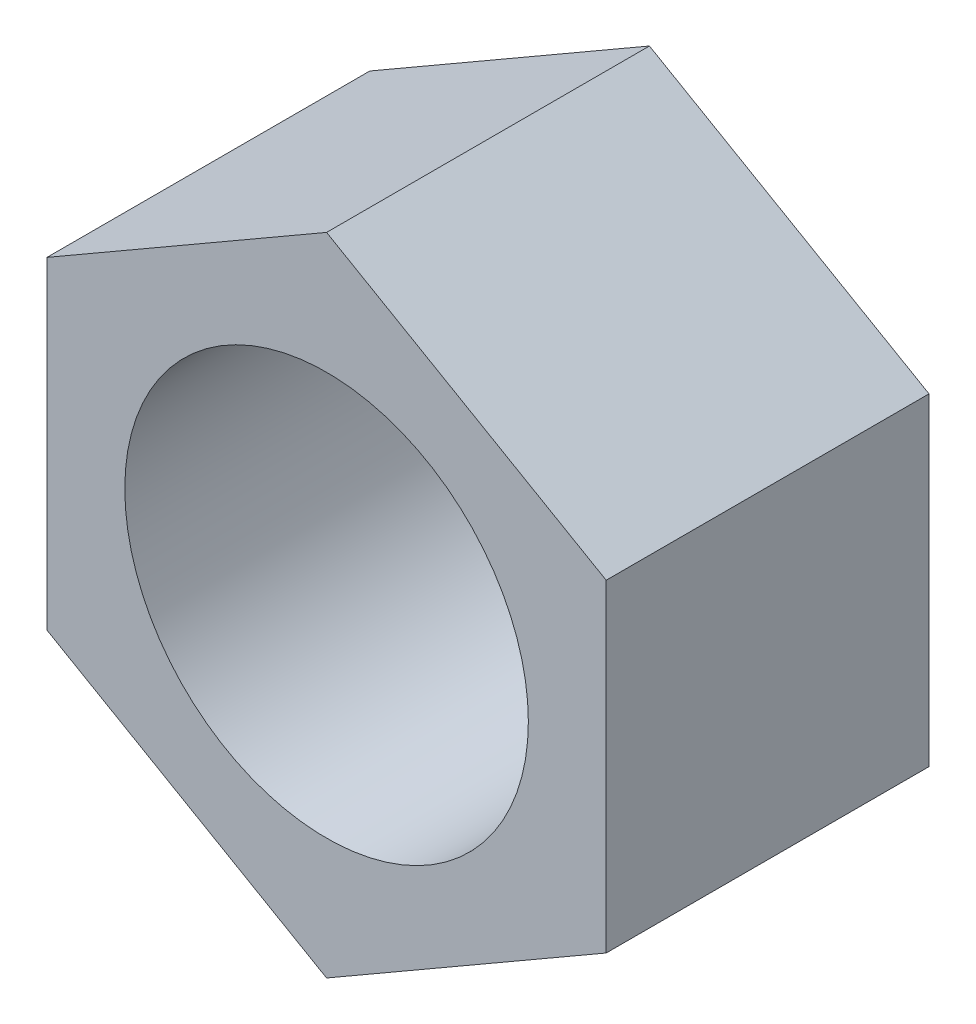
from build123d import *

# Parameters (mm, degrees)
BOSS_EXTRUDE1_DEPTH     = 12
CUT_EXTRUDE1_DEPTH      = 20.899748742
CUT_EXTRUDE1_DEPTH_BACK = 20.899748742
SKETCH2_R               = 7.5


with BuildPart() as part:
    # Sketch1 → Boss-Extrude1 (new body)
    with BuildSketch(Plane.XY):
        Polygon((0, -12), (10.392304845, -6), (10.392304845, 6), (0, 12), (-10.392304845, 6), (-10.392304845, -6), align=None)
    extrude(amount=BOSS_EXTRUDE1_DEPTH)

    # Sketch2 → Cut-Extrude1 (cut, two sides: drawn at the far end of the back side and taken through both)
    with BuildSketch(Plane.XY.offset(12).offset(-CUT_EXTRUDE1_DEPTH_BACK)):
        Circle(SKETCH2_R)
    extrude(amount=CUT_EXTRUDE1_DEPTH + CUT_EXTRUDE1_DEPTH_BACK, mode=Mode.SUBTRACT)


solid = part.part
